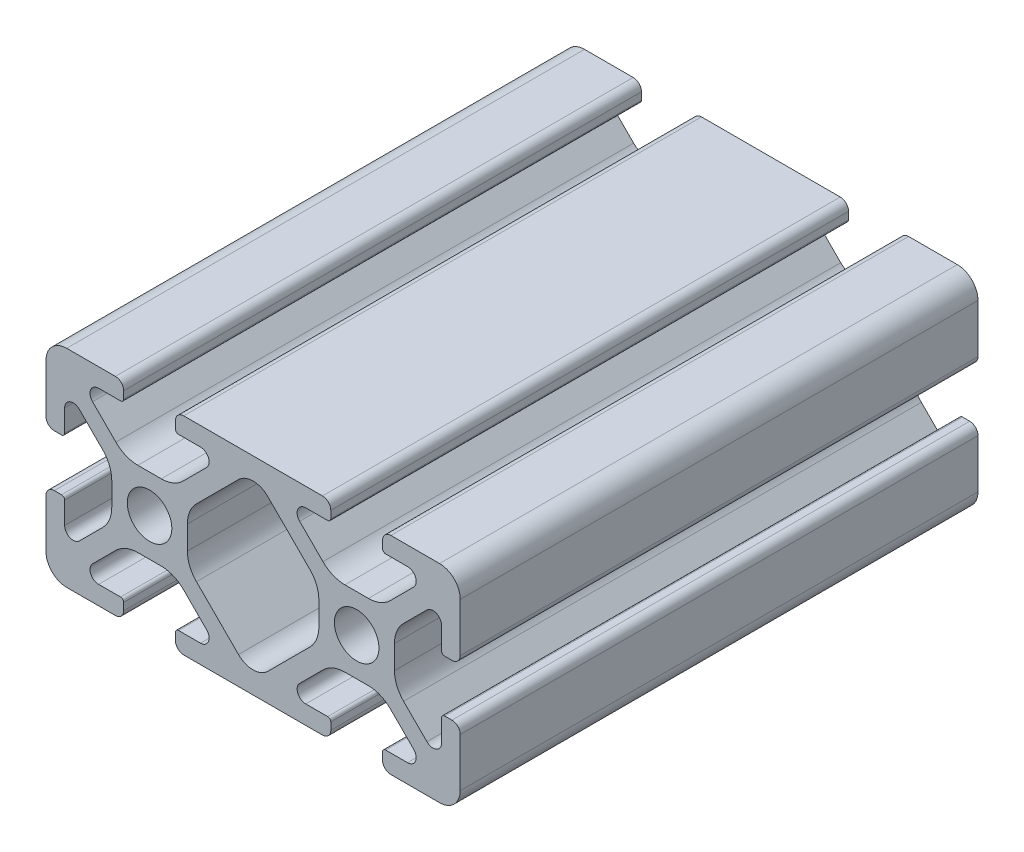
from build123d import *

# Parameters (mm, degrees)
ESQUISSE1_R        = 2.15
BOSS_EXTRU_1_DEPTH = 50


with BuildPart() as part:
    # Esquisse1 → Boss.-Extru.1 (new body)
    with BuildSketch(Plane(origin=(0, 0, 0), x_dir=(-1, 0, 0), z_dir=(0, 0, -1))):
        with BuildLine():
            Line((-40, 6.7), (-40, 2))
            ThreePointArc((-40, 2), (-39.414213562, 0.585786438), (-38, 0))
            Line((-38, 0), (-33.3, 0))
            ThreePointArc((-33.3, 0), (-32.734314575, 0.234314575), (-32.5, 0.8))
            Line((-32.5, 0.8), (-32.5, 1.5))
            ThreePointArc((-32.5, 1.5), (-32.587867966, 1.712132034), (-32.8, 1.8))
            Line((-32.8, 1.8), (-34.918424061, 1.8))
            ThreePointArc((-34.918424061, 1.8), (-35.686700051, 2.313345604), (-35.506437047, 3.219588924))
            Line((-35.506437047, 3.219588924), (-33.254705627, 5.471320344))
            ThreePointArc((-33.254705627, 5.471320344), (-32.281435581, 6.121638598), (-31.133385284, 6.35))
            Line((-31.133385284, 6.35), (-28.866614716, 6.35))
            ThreePointArc((-28.866614716, 6.35), (-27.718564419, 6.121638598), (-26.745294373, 5.471320344))
            Line((-26.745294373, 5.471320344), (-24.493562953, 3.219588924))
            ThreePointArc((-24.493562953, 3.219588924), (-24.313299949, 2.313345604), (-25.081575939, 1.8))
            Line((-25.081575939, 1.8), (-27.2, 1.8))
            ThreePointArc((-27.2, 1.8), (-27.412132034, 1.712132034), (-27.5, 1.5))
            Line((-27.5, 1.5), (-27.5, 0.8))
            ThreePointArc((-27.5, 0.8), (-27.265685425, 0.234314575), (-26.7, 0))
            Line((-26.7, 0), (-13.3, 0))
            ThreePointArc((-13.3, 0), (-12.734314575, 0.234314575), (-12.5, 0.8))
            Line((-12.5, 0.8), (-12.5, 1.5))
            ThreePointArc((-12.5, 1.5), (-12.587867966, 1.712132034), (-12.8, 1.8))
            Line((-12.8, 1.8), (-14.918424061, 1.8))
            ThreePointArc((-14.918424061, 1.8), (-15.686700051, 2.313345604), (-15.506437047, 3.219588924))
            Line((-15.506437047, 3.219588924), (-13.254705627, 5.471320344))
            ThreePointArc((-13.254705627, 5.471320344), (-12.281435581, 6.121638598), (-11.133385284, 6.35))
            Line((-11.133385284, 6.35), (-8.866614716, 6.35))
            ThreePointArc((-8.866614716, 6.35), (-7.718564419, 6.121638598), (-6.745294373, 5.471320344))
            Line((-6.745294373, 5.471320344), (-4.493562953, 3.219588924))
            ThreePointArc((-4.493562953, 3.219588924), (-4.313299949, 2.313345604), (-5.081575939, 1.8))
            Line((-5.081575939, 1.8), (-7.2, 1.8))
            ThreePointArc((-7.2, 1.8), (-7.412132034, 1.712132034), (-7.5, 1.5))
            Line((-7.5, 1.5), (-7.5, 0.8))
            ThreePointArc((-7.5, 0.8), (-7.265685425, 0.234314575), (-6.7, 0))
            Line((-6.7, 0), (-2, 0))
            ThreePointArc((-2, 0), (-0.585786438, 0.585786438), (0, 2))
            Line((0, 2), (0, 6.7))
            ThreePointArc((0, 6.7), (-0.234314575, 7.265685425), (-0.8, 7.5))
            Line((-0.8, 7.5), (-1.5, 7.5))
            ThreePointArc((-1.5, 7.5), (-1.712132034, 7.412132034), (-1.8, 7.2))
            Line((-1.8, 7.2), (-1.8, 5.081575939))
            ThreePointArc((-1.8, 5.081575939), (-2.313345604, 4.313299949), (-3.219588924, 4.493562953))
            Line((-3.219588924, 4.493562953), (-5.471320344, 6.745294373))
            ThreePointArc((-5.471320344, 6.745294373), (-6.121638598, 7.718564419), (-6.35, 8.866614716))
            Line((-6.35, 8.866614716), (-6.35, 11.133385284))
            ThreePointArc((-6.35, 11.133385284), (-6.121638598, 12.281435581), (-5.471320344, 13.254705627))
            Line((-5.471320344, 13.254705627), (-3.219588924, 15.506437047))
            ThreePointArc((-3.219588924, 15.506437047), (-2.313345604, 15.686700051), (-1.8, 14.918424061))
            Line((-1.8, 14.918424061), (-1.8, 12.8))
            ThreePointArc((-1.8, 12.8), (-1.712132034, 12.587867966), (-1.5, 12.5))
            Line((-1.5, 12.5), (-0.8, 12.5))
            ThreePointArc((-0.8, 12.5), (-0.234314575, 12.734314575), (0, 13.3))
            Line((0, 13.3), (0, 18))
            ThreePointArc((0, 18), (-0.585786438, 19.414213562), (-2, 20))
            Line((-2, 20), (-6.7, 20))
            ThreePointArc((-6.7, 20), (-7.265685425, 19.765685425), (-7.5, 19.2))
            Line((-7.5, 19.2), (-7.5, 18.5))
            ThreePointArc((-7.5, 18.5), (-7.412132034, 18.287867966), (-7.2, 18.2))
            Line((-7.2, 18.2), (-5.081575939, 18.2))
            ThreePointArc((-5.081575939, 18.2), (-4.313299949, 17.686654396), (-4.493562953, 16.780411076))
            Line((-4.493562953, 16.780411076), (-6.745294373, 14.528679656))
            ThreePointArc((-6.745294373, 14.528679656), (-7.718564419, 13.878361402), (-8.866614716, 13.65))
            Line((-8.866614716, 13.65), (-11.133385284, 13.65))
            ThreePointArc((-11.133385284, 13.65), (-12.281435581, 13.878361402), (-13.254705627, 14.528679656))
            Line((-13.254705627, 14.528679656), (-15.506437047, 16.780411076))
            ThreePointArc((-15.506437047, 16.780411076), (-15.686700051, 17.686654396), (-14.918424061, 18.2))
            Line((-14.918424061, 18.2), (-12.8, 18.2))
            ThreePointArc((-12.8, 18.2), (-12.587867966, 18.287867966), (-12.5, 18.5))
            Line((-12.5, 18.5), (-12.5, 19.2))
            ThreePointArc((-12.5, 19.2), (-12.734314575, 19.765685425), (-13.3, 20))
            Line((-13.3, 20), (-26.7, 20))
            ThreePointArc((-26.7, 20), (-27.265685425, 19.765685425), (-27.5, 19.2))
            Line((-27.5, 19.2), (-27.5, 18.5))
            ThreePointArc((-27.5, 18.5), (-27.412132034, 18.287867966), (-27.2, 18.2))
            Line((-27.2, 18.2), (-25.081575939, 18.2))
            ThreePointArc((-25.081575939, 18.2), (-24.313299949, 17.686654396), (-24.493562953, 16.780411076))
            Line((-24.493562953, 16.780411076), (-26.745294373, 14.528679656))
            ThreePointArc((-26.745294373, 14.528679656), (-27.718564419, 13.878361402), (-28.866614716, 13.65))
            Line((-28.866614716, 13.65), (-31.133385284, 13.65))
            ThreePointArc((-31.133385284, 13.65), (-32.281435581, 13.878361402), (-33.254705627, 14.528679656))
            Line((-33.254705627, 14.528679656), (-35.506437047, 16.780411076))
            ThreePointArc((-35.506437047, 16.780411076), (-35.686700051, 17.686654396), (-34.918424061, 18.2))
            Line((-34.918424061, 18.2), (-32.8, 18.2))
            ThreePointArc((-32.8, 18.2), (-32.587867966, 18.287867966), (-32.5, 18.5))
            Line((-32.5, 18.5), (-32.5, 19.2))
            ThreePointArc((-32.5, 19.2), (-32.734314575, 19.765685425), (-33.3, 20))
            Line((-33.3, 20), (-38, 20))
            ThreePointArc((-38, 20), (-39.414213562, 19.414213562), (-40, 18))
            Line((-40, 18), (-40, 13.3))
            ThreePointArc((-40, 13.3), (-39.765685425, 12.734314575), (-39.2, 12.5))
            Line((-39.2, 12.5), (-38.5, 12.5))
            ThreePointArc((-38.5, 12.5), (-38.287867966, 12.587867966), (-38.2, 12.8))
            Line((-38.2, 12.8), (-38.2, 14.918424061))
            ThreePointArc((-38.2, 14.918424061), (-37.686654396, 15.686700051), (-36.780411076, 15.506437047))
            Line((-36.780411076, 15.506437047), (-34.528679656, 13.254705627))
            ThreePointArc((-34.528679656, 13.254705627), (-33.878361402, 12.281435581), (-33.65, 11.133385284))
            Line((-33.65, 11.133385284), (-33.65, 8.866614716))
            ThreePointArc((-33.65, 8.866614716), (-33.878361402, 7.718564419), (-34.528679656, 6.745294373))
            Line((-34.528679656, 6.745294373), (-36.780411076, 4.493562953))
            ThreePointArc((-36.780411076, 4.493562953), (-37.686654396, 4.313299949), (-38.2, 5.081575939))
            Line((-38.2, 5.081575939), (-38.2, 7.2))
            ThreePointArc((-38.2, 7.2), (-38.287867966, 7.412132034), (-38.5, 7.5))
            Line((-38.5, 7.5), (-39.2, 7.5))
            ThreePointArc((-39.2, 7.5), (-39.765685425, 7.265685425), (-40, 6.7))
        make_face()
        with Locations(Location((-10, 10, 0), (0, 0, 180))):
            Circle(ESQUISSE1_R, mode=Mode.SUBTRACT)
        with Locations(Location((-30, 10, 0), (0, 0, 180))):
            Circle(ESQUISSE1_R, mode=Mode.SUBTRACT)
        with BuildLine():
            Line((-18.585786174, 17.312993861), (-14.528681072, 13.255889759))
            ThreePointArc((-14.528681072, 13.255889759), (-13.878362627, 12.282619622), (-13.650001154, 11.134569154))
            Line((-13.650001154, 11.134569154), (-13.650001154, 8.865431094))
            ThreePointArc((-13.650001154, 8.865431094), (-13.878362476, 7.717381202), (-14.5286805, 6.7441115))
            Line((-14.5286805, 6.7441115), (-18.585786, 2.687006))
            ThreePointArc((-18.585786, 2.687006), (-19.999999562, 2.101219562), (-21.414213125, 2.687006))
            Line((-21.414213125, 2.687006), (-25.471320125, 6.744113))
            ThreePointArc((-25.471320125, 6.744113), (-26.121638379, 7.717383046), (-26.349999781, 8.865433344))
            Line((-26.349999781, 8.865433344), (-26.349999781, 11.134567344))
            ThreePointArc((-26.349999781, 11.134567344), (-26.121638308, 12.282617811), (-25.471319863, 13.255887949))
            Line((-25.471319863, 13.255887949), (-21.41421295, 17.312993861))
            ThreePointArc((-21.41421295, 17.312993861), (-19.999999562, 17.898780125), (-18.585786174, 17.312993861))
        make_face(mode=Mode.SUBTRACT)
    extrude(amount=-BOSS_EXTRU_1_DEPTH)


solid = part.part
